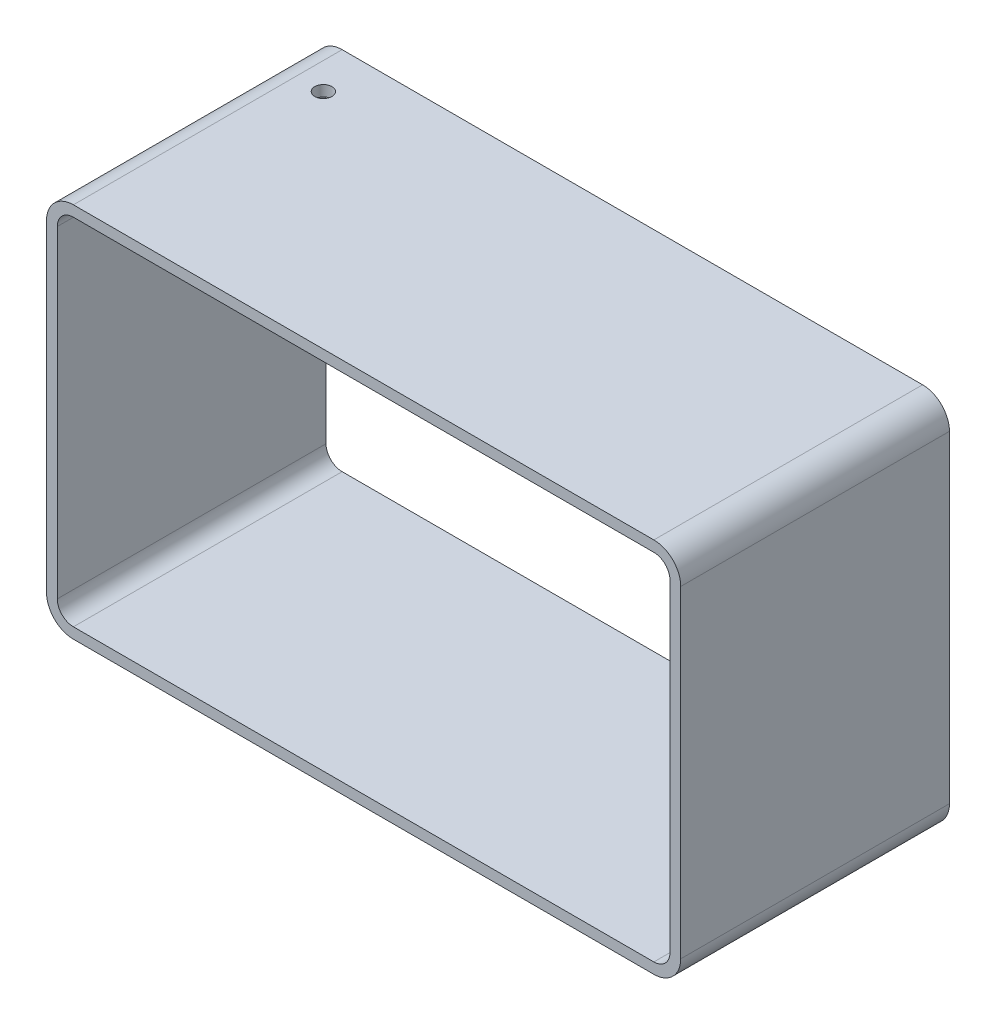
from build123d import *

# Parameters (mm, degrees)
SKETCH_1_W          = 118
SKETCH_1_H          = 70
EXTRUDE_1_DEPTH     = 50
FILLET_1_R          = 5
CUT_EXTRUDE_1_DEPTH = 85.888161719
CUT_EXTRUDE_2_REACH = 106.312
SKETCH_3_R          = 1.6
SKETCH_4_R          = 1.6
CUT_EXTRUDE_3_DEPTH = 50


with BuildPart() as part:
    # ｽｹｯﾁ1 → ﾎﾞｽ - 押し出し1 (new body)
    with BuildSketch(Plane.XY):
        Rectangle(SKETCH_1_W, SKETCH_1_H)
    extrude(amount=EXTRUDE_1_DEPTH)

    # ﾌｨﾚｯﾄ1
    fillet_1_edges = [part.edges().sort_by_distance(p)[0] for p in [
        (59, -35, 25),
        (-59, -35, 25),
        (-59, 35, 25),
        (59, 35, 25),
    ]]
    fillet(fillet_1_edges, radius=FILLET_1_R)

    # ｽｹｯﾁ2 → ｶｯﾄ - 押し出し1 (cut, through all)
    with BuildSketch(Plane.XY.offset(50)):
        with BuildLine():
            Line((-54, -33), (54, -33))
            ThreePointArc((54, -33), (56.121320344, -32.121320344), (57, -30))
            Line((57, -30), (57, 30))
            ThreePointArc((57, 30), (56.121320344, 32.121320344), (54, 33))
            Line((54, 33), (-54, 33))
            ThreePointArc((-54, 33), (-56.121320344, 32.121320344), (-57, 30))
            Line((-57, 30), (-57, -30))
            ThreePointArc((-57, -30), (-56.121320344, -32.121320344), (-54, -33))
        make_face()
    extrude(amount=-CUT_EXTRUDE_1_DEPTH, mode=Mode.SUBTRACT)

    # ｽｹｯﾁ3 → ｶｯﾄ - 押し出し2 (cut, up to next)
    with BuildSketch(Plane.XZ.offset(35), mode=Mode.PRIVATE) as cut_extrude_2_sk1:
        with Locations(Location((49, 8.5, 0), (0, 0, 270))):
            Circle(SKETCH_3_R)
    cut_extrude_2_tool1 = extrude(cut_extrude_2_sk1.sketch, amount=-CUT_EXTRUDE_2_REACH, mode=Mode.PRIVATE) & part.part
    add(cut_extrude_2_tool1.solids().sort_by_distance((49, -35, 8.5))[0], mode=Mode.SUBTRACT)

    # ｽｹｯﾁ4 → ｶｯﾄ - 押し出し3 (cut)
    with BuildSketch(Plane(origin=(0, 35, 0), x_dir=(1, 0, 0), z_dir=(0, 1, 0))):
        with Locations(Location((-49, -8.5, 0), (0, 0, 270))):
            Circle(SKETCH_4_R)
    extrude(amount=-CUT_EXTRUDE_3_DEPTH, mode=Mode.SUBTRACT)


solid = part.part
